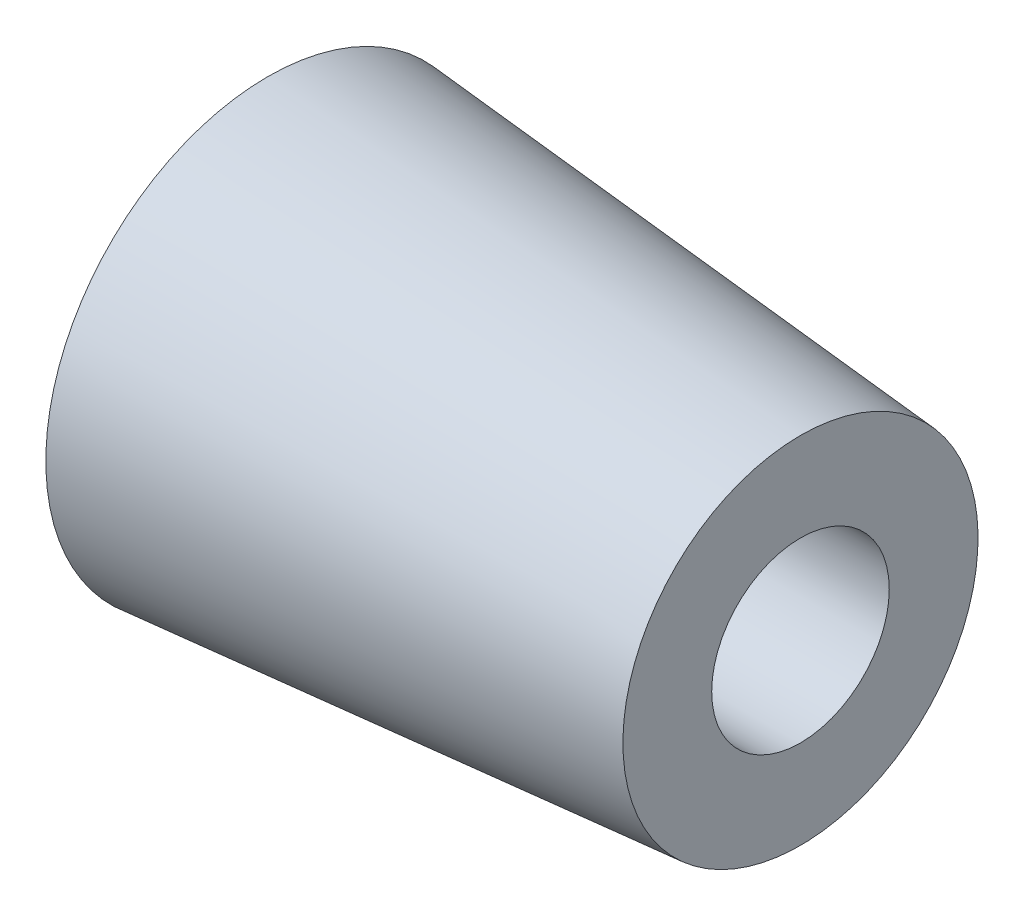
from build123d import *

# Parameters (mm, degrees)
CUT_EXTRUDE1_REACH = 8.964
SKETCH2_R          = 0.5


with BuildPart() as part:
    # Sketch1 → Revolve1 (revolve)
    with BuildSketch(Plane.XY):
        Polygon((0, 0), (0, 2.5), (6, 2), (6, 1), (2.75, 1), (2.75, 0), align=None)
    revolve(axis=Axis((2.75, 0, 0), (-1, 0, 0)))

    # Cut-Extrude1: up to this cone (the profile starts inside it)
    cut_extrude1_end = Plane(origin=(4, 0, 0), z_dir=(-1, 0, 0)) * Cone(1.197444444, 3.135888889, 23.261333333, mode=Mode.PRIVATE)
    # Sketch2 → Cut-Extrude1 (cut, up to the surface)
    with BuildSketch(Plane(origin=(0, 0, 0), x_dir=(1, 0, 0), z_dir=(0, 1, 0)), mode=Mode.PRIVATE) as cut_extrude1_sk1:
        with Locations(Location((4, 0, 0), (0, 0, 270))):
            Circle(SKETCH2_R)
    cut_extrude1_tool1 = extrude(cut_extrude1_sk1.sketch, amount=-CUT_EXTRUDE1_REACH, mode=Mode.PRIVATE) & cut_extrude1_end
    add(cut_extrude1_tool1.solids().sort_by_distance((4, 0, 0))[0], mode=Mode.SUBTRACT)


solid = part.part
